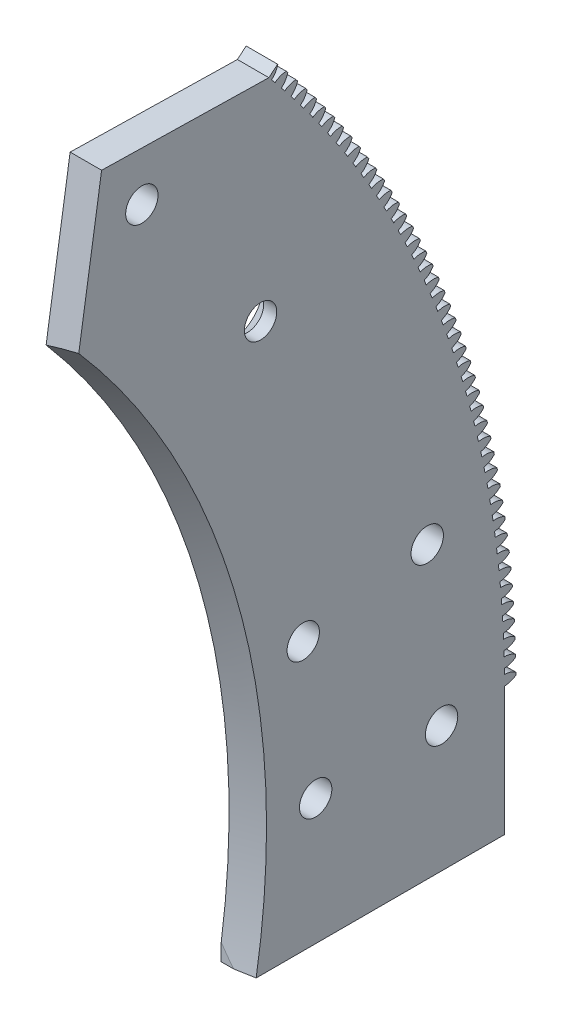
from build123d import *

# Parameters (mm, degrees)
BOSS_EXTRUDE2_DEPTH = 6.35
BOSS_EXTRUDE3_START = 6.35
BOSS_EXTRUDE3_DEPTH = 6.35
CUT_EXTRUDE4_DEPTH  = 6.35
CIRPATTERN3_COUNT   = 100
CIRPATTERN3_ANGLE   = 87.139364303
SKETCH2_R           = 3.2639
CUT_EXTRUDE5_DEPTH  = 6.35
SKETCH3_R           = 3.2639
CUT_EXTRUDE6_DEPTH  = 6.35
SKETCH15_R          = 3.2639
CUT_EXTRUDE7_DEPTH  = 245.371308652


with BuildPart() as part:
    # Sketch11 → Boss-Extrude2 (new body)
    with BuildSketch(Plane(origin=(6.35, 0, 0), x_dir=(0, 0, -1), z_dir=(1, 0, 0))):
        with BuildLine():
            Line((203.2, 0), (205.500006576, 0))
            ThreePointArc((205.500006576, 0), (193.106839751, 70.285141703), (157.422138098, 132.092858018))
            Line((157.422138098, 132.092858018), (155.660230842, 130.614442288))
            ThreePointArc((155.660230842, 130.614442288), (190.945540544, 69.498493124), (203.2, 0))
        make_face()
    extrude(amount=-BOSS_EXTRUDE2_DEPTH)

    # Sketch1 → Boss-Extrude3 (add)
    with BuildSketch(Plane(origin=(0, 0, 0), x_dir=(0, 0, -1), z_dir=(1, 0, 0)).offset(BOSS_EXTRUDE3_START)):
        with BuildLine():
            Line((152.4, 0), (152.4, -25.4))
            Line((152.4, -25.4), (203.2, -25.4))
            Line((203.2, -25.4), (203.2, 0))
            ThreePointArc((203.2, 0), (190.945540544, 69.498493124), (155.660230842, 130.614442288))
            Line((155.660230842, 130.614442288), (121.916747361, 131.312974751))
            Line((121.916747361, 131.312974751), (116.745173131, 97.960831716))
            ThreePointArc((116.745173131, 97.960831716), (143.209155408, 52.123869843), (152.4, 0))
        make_face()
    extrude(amount=-BOSS_EXTRUDE3_DEPTH)

    # Sketch12 → Cut-Extrude4 (cut)
    with BuildSketch(Plane(origin=(6.35, 0, 0), x_dir=(0, 0, -1), z_dir=(1, 0, 0))):
        with BuildLine():
            ThreePointArc((203.199243498, 0.554474368), (205.09127366, 1.060489201), (206.485639768, 2.43583363))
            ThreePointArc((206.485639768, 2.43583363), (206.496414843, 1.217937999), (206.500006576, 0))
            ThreePointArc((206.500006576, 0), (206.496414843, -1.217937999), (206.485639768, -2.43583363))
            ThreePointArc((206.485639768, -2.43583363), (205.09127366, -1.060489201), (203.199243498, -0.554474368))
            ThreePointArc((203.199243498, -0.554474368), (203.2, 0), (203.199243498, 0.554474368))
        make_face()
    cut_extrude4 = extrude(amount=-CUT_EXTRUDE4_DEPTH, mode=Mode.SUBTRACT)

    # CirPattern3: Cut-Extrude4 ×100 about axis
    cirpattern3_axis = Axis((0, 0, 0), (1, 0, 0))
    for i in range(1, CIRPATTERN3_COUNT):
        add(cut_extrude4.rotate(cirpattern3_axis, i * CIRPATTERN3_ANGLE / (CIRPATTERN3_COUNT - 1)), mode=Mode.SUBTRACT)

    # Sketch2 → Cut-Extrude5 (cut)
    with BuildSketch(Plane(origin=(6.35, 0, 0), x_dir=(0, 0, -1), z_dir=(1, 0, 0))):
        with Locations((165.1, 0)):
            Circle(SKETCH2_R)
        with Locations((190.5, 0)):
            Circle(SKETCH2_R)
        with Locations((162.591760022, 28.669314133)):
            Circle(SKETCH2_R)
        with Locations((187.605876949, 33.079977846)):
            Circle(SKETCH2_R)
    extrude(amount=-CUT_EXTRUDE5_DEPTH, mode=Mode.SUBTRACT)

    # Sketch3 → Cut-Extrude6 (cut)
    with BuildSketch(Plane(origin=(6.35, 0, 0), x_dir=(0, 0, -1), z_dir=(1, 0, 0))):
        with Locations((153.979316793, 88.9)):
            Circle(SKETCH3_R)
    extrude(amount=-CUT_EXTRUDE6_DEPTH, mode=Mode.SUBTRACT)

    # Sketch15 → Cut-Extrude7 (cut, through all)
    with BuildSketch(Plane(origin=(6.35, 0, 0), x_dir=(0, 0, -1), z_dir=(1, 0, 0))):
        with Locations((130.034688148, 121.259308419)):
            Circle(SKETCH15_R)
    extrude(amount=-CUT_EXTRUDE7_DEPTH, mode=Mode.SUBTRACT)

    # Sketch19 → Cut-Revolve1 (revolve, cut)
    with BuildSketch(Plane(origin=(0, 0, 0), x_dir=(1, 0, 0), z_dir=(0, 0.8660254037844382, 0.500000000000001)), mode=Mode.PRIVATE) as cut_revolve1_sk:
        Polygon((0, 177.8), (0, 170.815), (6.985, 177.8), align=None)
    revolve(cut_revolve1_sk.sketch.rotate(Axis((0, 88.9, -153.979316793), (1, 0, 0)), 150), axis=Axis((0, 88.9, -153.979316793), (1, 0, 0)), mode=Mode.SUBTRACT)

    # Sketch21 → Cut-Revolve2 (revolve, cut)
    with BuildSketch(Plane(origin=(0, 0, 0), x_dir=(1, 0, 0), z_dir=(0, 1, 0))):
        with BuildLine():
            Line((25.4, 38.1), (144.027789746, 38.1))
            ThreePointArc((144.027789746, 38.1), (25.4, 156.727789746), (-93.227789746, 38.1))
            Line((-93.227789746, 38.1), (25.4, 38.1))
        make_face()
    revolve(axis=Axis((-1006.35, 0, 0), (1, 0, 0)), mode=Mode.SUBTRACT)


solid = part.part
